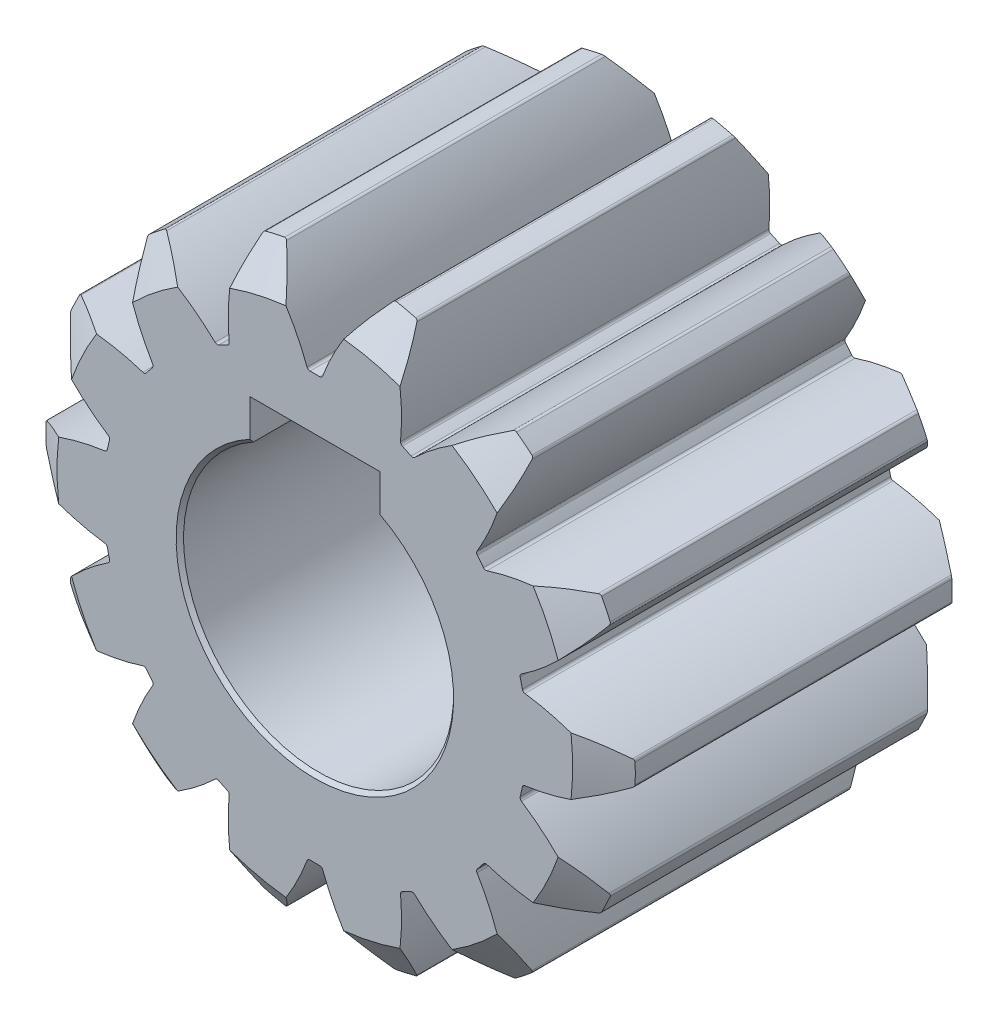
from build123d import *

# Parameters (mm, degrees)
SKETCH_11_R                            = 8.625
EXTRUDE_A_DEPTH                        = 15
EXTRUDE_START                          = -15
EXTRUDE_B_DEPTH                        = 15
FILLET_1047_R                          = 0.125
PATTERN_CIRCULAR_1410_COUNT            = 14
FILLET_1047_OF_PATTERN_CIRCULAR_1410_R = 0.125
SKETCH_4_R                             = 13.5
SKETCH_4_R_2                           = 10.5
CUT_EXTRUDE_6131_DEPTH                 = 1.5
CUT_EXTRUDE_6131_DRAFT                 = -55
CUT_EXTRUDE_START                      = -15
SKETCH_4_2_R                           = 13.5
SKETCH_4_2_R_2                         = 10.5
CUT_EXTRUDE_2_DEPTH                    = 1.5
CUT_EXTRUDE_2_DRAFT                    = 55
SKETCH_13_R                            = 5.5
CUT_EXTRUDE_4_DEPTH                    = 23.53581412
CHAMFER_1_SIZE                         = 0.15
SKETCH_14_W                            = 5.3
SKETCH_14_H                            = 3
CUT_EXTRUDE_12267_DEPTH                = 23.53581412


with BuildPart() as part:
    # 草图11 → 拉伸-齿轮a (new body)
    with BuildSketch(Plane(origin=(-11.8785, -4, 0), x_dir=(1, 0, 0), z_dir=(0, 0, 1))):
        with Locations((11.8785, 4)):
            Circle(SKETCH_11_R)
    extrude(amount=-EXTRUDE_A_DEPTH)

    # 草图3 → 拉伸-齿轮b (add)
    with BuildSketch(Plane(origin=(-1.36106, -4, 0), x_dir=(1, 0, 0), z_dir=(0, 0, 1)).offset(EXTRUDE_START)):
        with BuildLine():
            ThreePointArc((9.828840861, 2.360697623), (9.98606, 4), (9.828840861, 5.639302377))
            ThreePointArc((9.828840861, 5.639302377), (11.646976165, 5.226057618), (13.351808435, 4.471117789))
            ThreePointArc((13.351808435, 4.471117789), (13.36106, 4), (13.351808435, 3.528882211))
            ThreePointArc((13.351808435, 3.528882211), (11.646976165, 2.773942382), (9.828840861, 2.360697623))
        make_face()
    extrude_b = extrude(amount=EXTRUDE_B_DEPTH)

    # Fillet 1047
    fillet_1047_edges = [part.edges().sort_by_distance(p)[0] for p in [
        (11.990748435, -0.471117789, -7.5),
        (8.467780861, -1.639302377, -7.5),
        (8.467780861, 1.639302377, -7.5),
        (11.990748435, 0.471117789, -7.5),
    ]]
    fillet(fillet_1047_edges, radius=FILLET_1047_R)

    # Pattern Circular 1410: 拉伸-齿轮b ×14 about axis
    pattern_circular_1410_axis = Axis((0, 0, 0), (0, 0, 1))
    for i in range(1, PATTERN_CIRCULAR_1410_COUNT):
        add(extrude_b.rotate(pattern_circular_1410_axis, i * 360 / PATTERN_CIRCULAR_1410_COUNT))

    # Fillet 1047 of Pattern Circular 1410
    fillet_1047_of_pattern_circular_1410_edges = [part.edges().sort_by_distance(p)[0] for p in [
        (11.007701391, 4.778128305, -7.5),
        (8.340473581, 2.197072015, -7.5),
        (6.917940291, 5.150992829, -7.5),
        (10.598880695, 5.627053227, -7.5),
        (7.844444085, 9.081007488, -7.5),
        (6.561233219, 5.59828935, -7.5),
        (3.997916804, 7.642465978, -7.5),
        (7.107774646, 9.668481762, -7.5),
        (3.127498423, 11.585281767, -7.5),
        (3.48246015, 7.89069682, -7.5),
        (0.286056862, 8.620255012, -7.5),
        (2.208886658, 11.794948908, -7.5),
        (-2.208886658, 11.794948908, -7.5),
        (-0.286056862, 8.620255012, -7.5),
        (-3.48246015, 7.89069682, -7.5),
        (-3.127498423, 11.585281767, -7.5),
        (-7.107774646, 9.668481762, -7.5),
        (-3.997916804, 7.642465978, -7.5),
        (-6.561233219, 5.59828935, -7.5),
        (-7.844444085, 9.081007488, -7.5),
        (-10.598880695, 5.627053227, -7.5),
        (-6.917940291, 5.150992829, -7.5),
        (-8.340473581, 2.197072015, -7.5),
        (-11.007701391, 4.778128305, -7.5),
        (-11.990748435, 0.471117789, -7.5),
        (-8.467780861, 1.639302377, -7.5),
        (-8.467780861, -1.639302377, -7.5),
        (-11.990748435, -0.471117789, -7.5),
        (-11.007701391, -4.778128305, -7.5),
        (-8.340473581, -2.197072015, -7.5),
        (-6.917940291, -5.150992829, -7.5),
        (-10.598880695, -5.627053227, -7.5),
        (-7.844444085, -9.081007488, -7.5),
        (-6.561233219, -5.59828935, -7.5),
        (-3.997916804, -7.642465978, -7.5),
        (-7.107774646, -9.668481762, -7.5),
        (-3.127498423, -11.585281767, -7.5),
        (-3.48246015, -7.89069682, -7.5),
        (-0.286056862, -8.620255012, -7.5),
        (-2.208886658, -11.794948908, -7.5),
        (2.208886658, -11.794948908, -7.5),
        (0.286056862, -8.620255012, -7.5),
        (3.48246015, -7.89069682, -7.5),
        (3.127498423, -11.585281767, -7.5),
        (7.107774646, -9.668481762, -7.5),
        (3.997916804, -7.642465978, -7.5),
        (6.561233219, -5.59828935, -7.5),
        (7.844444085, -9.081007488, -7.5),
        (10.598880695, -5.627053227, -7.5),
        (6.917940291, -5.150992829, -7.5),
        (8.340473581, -2.197072015, -7.5),
        (11.007701391, -4.778128305, -7.5),
    ]]
    fillet(fillet_1047_of_pattern_circular_1410_edges, radius=FILLET_1047_OF_PATTERN_CIRCULAR_1410_R)


with BuildPart() as cut_extrude_6131_tool:
    # 草图4 → Cut-Extrude 6131 (with draft: the straight prism first)
    with BuildSketch(Plane(origin=(0, 0, -15), x_dir=(-1, 0, 0), z_dir=(0, 0, -1))):
        Circle(SKETCH_4_R)
        Circle(SKETCH_4_R_2, mode=Mode.SUBTRACT)
    extrude(amount=-CUT_EXTRUDE_6131_DEPTH)
    # Cut-Extrude 6131: the draft: its side faces are tilted about the plane it starts from
    cut_extrude_6131_sides = [cut_extrude_6131_tool.faces().sort_by_distance(p)[0] for p in [
        (13.5, 0, -14.25),
        (10.5, 0, -14.25),
    ]]
    draft(cut_extrude_6131_sides, Plane(origin=(0, 0, -15), x_dir=(-1, 0, 0), z_dir=(0, 0, -1)), CUT_EXTRUDE_6131_DRAFT)


with BuildPart() as part_1:
    add(part.part)

    # Cut-Extrude 6131: cut by cut_extrude_6131_tool
    add(cut_extrude_6131_tool.part, mode=Mode.SUBTRACT)


with BuildPart() as cut_extrude_2_tool:
    # 草图4<2> → 切除-拉伸2 (with draft: the straight prism first)
    with BuildSketch(Plane(origin=(0, 0, -15), x_dir=(-1, 0, 0), z_dir=(0, 0, -1)).offset(CUT_EXTRUDE_START)):
        Circle(SKETCH_4_2_R)
        Circle(SKETCH_4_2_R_2, mode=Mode.SUBTRACT)
    extrude(amount=CUT_EXTRUDE_2_DEPTH)
    # 切除-拉伸2: the draft: its side faces are tilted about the plane it starts from
    cut_extrude_2_sides = [cut_extrude_2_tool.faces().sort_by_distance(p)[0] for p in [
        (13.5, 0, -0.75),
        (10.5, 0, -0.75),
    ]]
    draft(cut_extrude_2_sides, Plane(origin=(0, 0, -15), x_dir=(-1, 0, 0), z_dir=(0, 0, -1)).offset(CUT_EXTRUDE_START), CUT_EXTRUDE_2_DRAFT)


with BuildPart() as part_2:
    add(part_1.part)

    # 切除-拉伸2: cut by cut_extrude_2_tool
    add(cut_extrude_2_tool.part, mode=Mode.SUBTRACT)

    # 草图13 → 切除-拉伸4 (cut, through all)
    with BuildSketch(Plane.XY):
        Circle(SKETCH_13_R)
    extrude(amount=-CUT_EXTRUDE_4_DEPTH, mode=Mode.SUBTRACT)

    # 倒角1
    chamfer_1_edges = [part_2.edges().sort_by_distance(p)[0] for p in [
        (-5.5, 0, -15),
        (-5.5, 0, 0),
    ]]
    chamfer(chamfer_1_edges, length=CHAMFER_1_SIZE)

    # 草图14 → Cut-Extrude 12267 (cut, through all)
    with BuildSketch(Plane(origin=(0, 0, -15), x_dir=(-1, 0, 0), z_dir=(0, 0, -1))):
        with Locations((0, 5)):
            Rectangle(SKETCH_14_W, SKETCH_14_H)
    extrude(amount=-CUT_EXTRUDE_12267_DEPTH, mode=Mode.SUBTRACT)


solid = part_2.part
